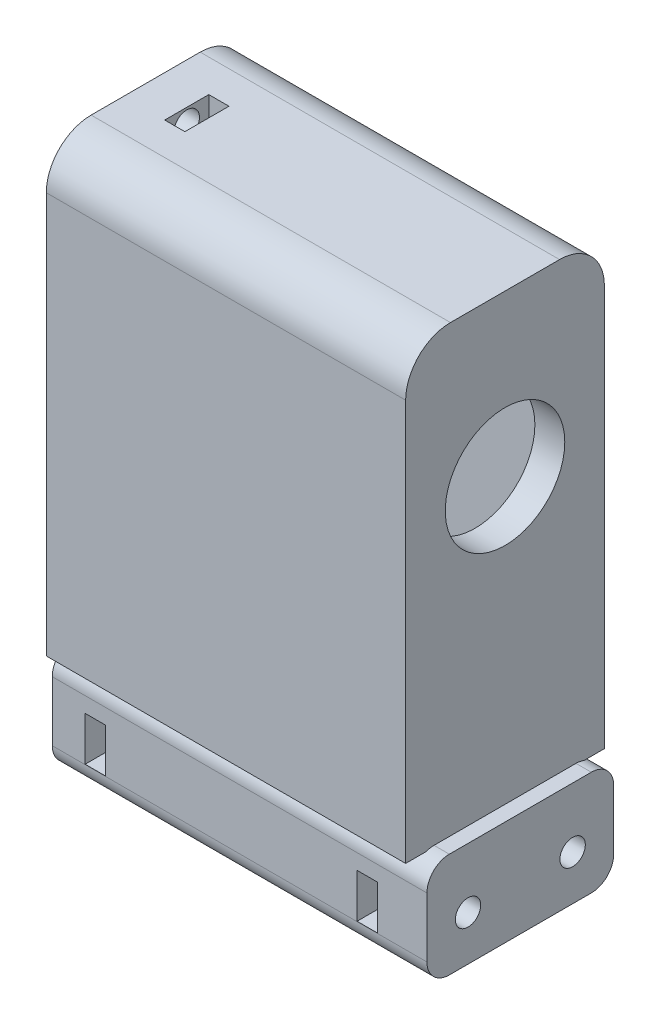
from build123d import *

# Parameters (mm, degrees)
TAIL_START              = -21.9
TAIL_BLOCK_DEPTH        = 50.15
NOSE_START              = 22.2
SKETCH2_R               = 8
NOSE_WALL_X_DEPTH       = 4
NOSE_START_2            = -21.9
NOSE_WALLS_DEPTH        = 44.3
HEAD_START              = 8.2
SKETCH4_W               = 21
SKETCH4_H               = 8
HEAD_SERVO_LEDGES_DEPTH = 14.2
TAB_START               = 8
SKETCH5_R               = 1.7
TAB_BOLT_HOLES_DEPTH    = 9.2
TAB_START_2             = 11.7
TAB_NUT_SLOTS_DEPTH     = 2.7
MOUNT_START             = -22.1
SKETCH7_R               = 1.7
MOUNT_BOLT_HOLES_DEPTH  = 50.55
COVER_START             = -22.1
SKETCH8_R               = 1.7
COVER_BOLT_HOLE_DEPTH   = 14.1
D_SIDE_START            = 18.9
D_SIDE_NUT_SLOTS_DEPTH  = 2.7
I_SIDE_START            = -17.5
I_SIDE_NUT_SLOTS_DEPTH  = 2.7
COVER_START_2           = -16.4
COVER_NUT_SLOT_DEPTH    = 2.7
LEAD_START              = -22.1
SKETCH12_W              = 8
SKETCH12_H              = 14.6
LEAD_CHANNEL_DEPTH      = 14.1


with BuildPart() as part:
    # Sketch1 → Tail block (new body)
    with BuildSketch(Plane(origin=(0, 0, 0), x_dir=(0, 0, -1), z_dir=(1, 0, 0)).offset(TAIL_START)):
        with BuildLine():
            Line((-1.5, 271.5), (-1.5, 279.5))
            ThreePointArc((-1.5, 279.5), (-2.378679656, 281.621320344), (-4.5, 282.5))
            Line((-4.5, 282.5), (-23.5, 282.5))
            ThreePointArc((-23.5, 282.5), (-25.621320344, 281.621320344), (-26.5, 279.5))
            Line((-26.5, 279.5), (-26.5, 271.5))
            ThreePointArc((-26.5, 271.5), (-25.621320344, 269.378679656), (-23.5, 268.5))
            Line((-23.5, 268.5), (-4.5, 268.5))
            ThreePointArc((-4.5, 268.5), (-2.378679656, 269.378679656), (-1.5, 271.5))
        make_face()
    extrude(amount=TAIL_BLOCK_DEPTH)

    # Sketch2 → Nose wall +X (add)
    with BuildSketch(Plane(origin=(0, 0, 0), x_dir=(0, 0, -1), z_dir=(1, 0, 0)).offset(NOSE_START)):
        with BuildLine():
            Line((-0.7, 282.3), (-0.7, 336))
            ThreePointArc((-0.7, 336), (-2.457359313, 340.242640687), (-6.7, 342))
            Line((-6.7, 342), (-21.3, 342))
            ThreePointArc((-21.3, 342), (-25.542640687, 340.242640687), (-27.3, 336))
            Line((-27.3, 336), (-27.3, 282.3))
            Line((-27.3, 282.3), (-0.7, 282.3))
        make_face()
        with Locations((-14, 320.5)):
            Circle(SKETCH2_R, mode=Mode.SUBTRACT)
    extrude(amount=NOSE_WALL_X_DEPTH)

    # Sketch3 → Nose walls (add)
    with BuildSketch(Plane(origin=(0, 0, 0), x_dir=(0, 0, -1), z_dir=(1, 0, 0)).offset(NOSE_START_2)):
        with BuildLine():
            Line((-0.7, 282.3), (-0.7, 336))
            ThreePointArc((-0.7, 336), (-2.457359313, 340.242640687), (-6.7, 342))
            Line((-6.7, 342), (-21.3, 342))
            ThreePointArc((-21.3, 342), (-25.542640687, 340.242640687), (-27.3, 336))
            Line((-27.3, 336), (-27.3, 282.3))
            Line((-27.3, 282.3), (-24.3, 282.3))
            Line((-24.3, 282.3), (-24.3, 337))
            ThreePointArc((-24.3, 337), (-24.007106781, 337.707106781), (-23.3, 338))
            Line((-23.3, 338), (-4.7, 338))
            ThreePointArc((-4.7, 338), (-3.992893219, 337.707106781), (-3.7, 337))
            Line((-3.7, 337), (-3.7, 282.3))
            Line((-3.7, 282.3), (-0.7, 282.3))
        make_face()
    extrude(amount=NOSE_WALLS_DEPTH)

    # Sketch4 → Head servo ledges (add)
    with BuildSketch(Plane(origin=(0, 0, 0), x_dir=(0, 0, -1), z_dir=(1, 0, 0)).offset(HEAD_START)):
        with Locations((-14, 334.9)):
            Rectangle(SKETCH4_W, SKETCH4_H)
        with Locations((-14, 285.4)):
            Rectangle(SKETCH4_W, SKETCH4_H)
    extrude(amount=HEAD_SERVO_LEDGES_DEPTH)

    # Sketch5 → Tab bolt holes (cut)
    with BuildSketch(Plane(origin=(0, 0, 0), x_dir=(0, 0, -1), z_dir=(1, 0, 0)).offset(TAB_START)):
        with Locations((-9, 334.9)):
            Circle(SKETCH5_R)
        with Locations((-19, 334.9)):
            Circle(SKETCH5_R)
        with Locations((-9, 285.4)):
            Circle(SKETCH5_R)
        with Locations((-19, 285.4)):
            Circle(SKETCH5_R)
    extrude(amount=TAB_BOLT_HOLES_DEPTH, mode=Mode.SUBTRACT)

    # Sketch6 → Tab nut slots (cut)
    with BuildSketch(Plane(origin=(0, 0, 0), x_dir=(0, 0, -1), z_dir=(1, 0, 0)).offset(TAB_START_2)):
        Polygon((-6.05, 333.196816706), (-6.05, 336.603183294), (-9, 338.306366588), (-11.95, 336.603183294), (-11.95, 333.196816706), (-11.95, 330.4), (-6.05, 330.4), align=None)
        Polygon((-16.05, 333.196816706), (-16.05, 336.603183294), (-19, 338.306366588), (-21.95, 336.603183294), (-21.95, 333.196816706), (-21.95, 330.4), (-16.05, 330.4), align=None)
        Polygon((-11.95, 287.103183294), (-11.95, 283.696816706), (-9, 281.993633412), (-6.05, 283.696816706), (-6.05, 287.103183294), (-6.05, 289.9), (-11.95, 289.9), align=None)
        Polygon((-21.95, 287.103183294), (-21.95, 283.696816706), (-19, 281.993633412), (-16.05, 283.696816706), (-16.05, 287.103183294), (-16.05, 289.9), (-21.95, 289.9), align=None)
    extrude(amount=TAB_NUT_SLOTS_DEPTH, mode=Mode.SUBTRACT)

    # Sketch7 → Mount bolt holes (cut)
    with BuildSketch(Plane(origin=(0, 0, 0), x_dir=(0, 0, -1), z_dir=(1, 0, 0)).offset(MOUNT_START)):
        with Locations(Location((-7, 274.5, 0), (0, 0, 180))):
            Circle(SKETCH7_R)
        with Locations(Location((-21, 274.5, 0), (0, 0, 180))):
            Circle(SKETCH7_R)
    extrude(amount=MOUNT_BOLT_HOLES_DEPTH, mode=Mode.SUBTRACT)

    # Sketch8 → Cover bolt hole (cut)
    with BuildSketch(Plane(origin=(0, 0, 0), x_dir=(0, 0, -1), z_dir=(1, 0, 0)).offset(COVER_START)):
        with Locations((-14, 340)):
            Circle(SKETCH8_R)
    extrude(amount=COVER_BOLT_HOLE_DEPTH, mode=Mode.SUBTRACT)

    # Sketch9 → D-side nut slots (cut)
    with BuildSketch(Plane(origin=(0, 0, 0), x_dir=(0, 0, -1), z_dir=(1, 0, 0)).offset(D_SIDE_START)):
        Polygon((-5.296816706, 277.45), (-8.703183294, 277.45), (-10.406366588, 274.5), (-8.703183294, 271.55), (-5.296816706, 271.55), (-1, 271.55), (-1, 277.45), align=None)
        Polygon((-22.703183294, 271.55), (-19.296816706, 271.55), (-17.593633412, 274.5), (-19.296816706, 277.45), (-22.703183294, 277.45), (-27, 277.45), (-27, 271.55), align=None)
    extrude(amount=D_SIDE_NUT_SLOTS_DEPTH, mode=Mode.SUBTRACT)

    # Sketch10 → I-side nut slots (cut)
    with BuildSketch(Plane(origin=(0, 0, 0), x_dir=(0, 0, -1), z_dir=(1, 0, 0)).offset(I_SIDE_START)):
        Polygon((-5.296816706, 277.45), (-8.703183294, 277.45), (-10.406366588, 274.5), (-8.703183294, 271.55), (-5.296816706, 271.55), (-1, 271.55), (-1, 277.45), align=None)
        Polygon((-22.703183294, 271.55), (-19.296816706, 271.55), (-17.593633412, 274.5), (-19.296816706, 277.45), (-22.703183294, 277.45), (-27, 277.45), (-27, 271.55), align=None)
    extrude(amount=I_SIDE_NUT_SLOTS_DEPTH, mode=Mode.SUBTRACT)

    # Sketch11 → Cover nut slot (cut)
    with BuildSketch(Plane(origin=(0, 0, 0), x_dir=(0, 0, -1), z_dir=(1, 0, 0)).offset(COVER_START_2)):
        Polygon((-16.95, 341.703183294), (-16.95, 338.296816706), (-14, 336.593633412), (-11.05, 338.296816706), (-11.05, 341.703183294), (-11.05, 342.5), (-16.95, 342.5), align=None)
    extrude(amount=COVER_NUT_SLOT_DEPTH, mode=Mode.SUBTRACT)

    # Sketch12 → Lead channel (cut)
    with BuildSketch(Plane(origin=(0, 0, 0), x_dir=(0, 0, -1), z_dir=(1, 0, 0)).offset(LEAD_START)):
        with Locations((-14, 275.5)):
            Rectangle(SKETCH12_W, SKETCH12_H)
    extrude(amount=LEAD_CHANNEL_DEPTH, mode=Mode.SUBTRACT)


solid = part.part
